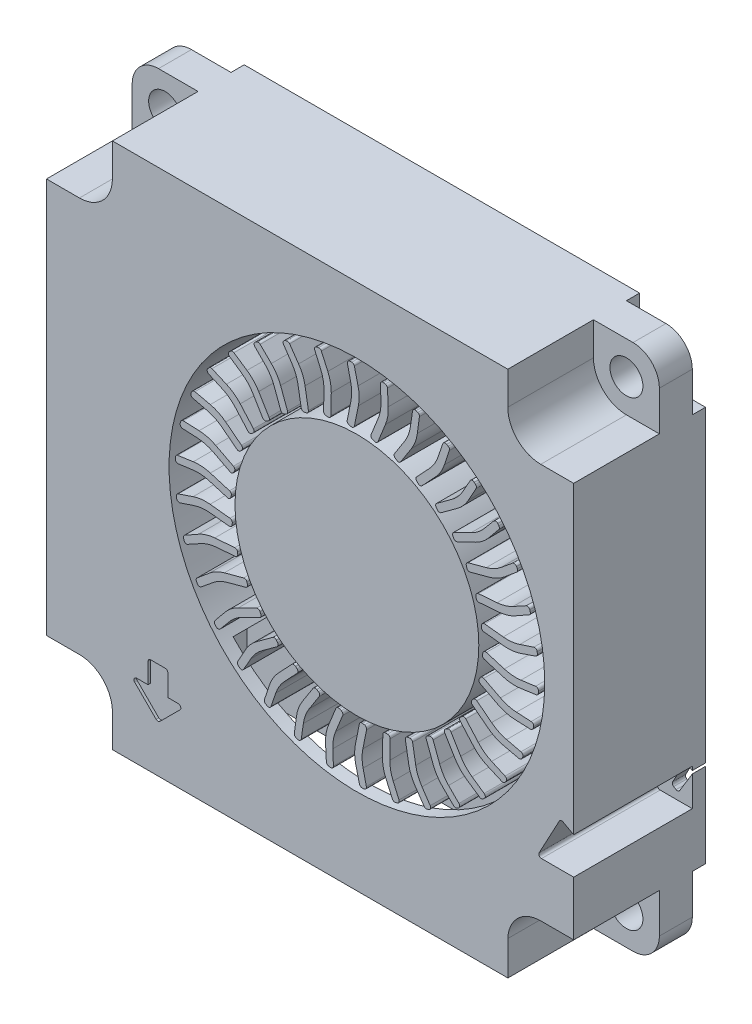
from build123d import *

# Parameters (mm, degrees)
SKETCH_1_R          = 1.25
EXTRUDE_1_DEPTH     = 10
CUT_EXTRUDE_1_DEPTH = 6.5
CUT_EXTRUDE_START   = -9
CUT_EXTRUDE_2_DEPTH = 6.5
SKETCH_5_W          = 27.606686678
SKETCH_5_H          = 8
CUT_EXTRUDE_3_DEPTH = 11
SKETCH_6_R          = 14.25
SKETCH_6_R_2        = 9.25
CUT_EXTRUDE_4_DEPTH = 8
EXTRUDE_2_DEPTH     = 8
CUT_EXTRUDE_5_DEPTH = 0.2
CUT_EXTRUDE_6_DEPTH = 9
CUT_EXTRUDE_7_DEPTH = 9


with BuildPart() as part:
    # Эскиз1 → Бобышка-Вытянуть1 (new body)
    with BuildSketch(Plane.XY):
        with BuildLine():
            Line((2, 0), (38, 0))
            ThreePointArc((38, 0), (39.414213562, 0.585786438), (40, 2))
            Line((40, 2), (40, 38))
            ThreePointArc((40, 38), (39.414213562, 39.414213562), (38, 40))
            Line((38, 40), (2, 40))
            ThreePointArc((2, 40), (0.585786438, 39.414213562), (0, 38))
            Line((0, 38), (0, 2))
            ThreePointArc((0, 2), (0.585786438, 0.585786438), (2, 0))
        make_face()
        with Locations((2.5, 37.5)):
            Circle(SKETCH_1_R, mode=Mode.SUBTRACT)
        with Locations((37.5, 37.5)):
            Circle(SKETCH_1_R, mode=Mode.SUBTRACT)
        with Locations((37.5, 2.5)):
            Circle(SKETCH_1_R, mode=Mode.SUBTRACT)
        with Locations((2.5, 2.5)):
            Circle(SKETCH_1_R, mode=Mode.SUBTRACT)
    extrude(amount=EXTRUDE_1_DEPTH)

    # Эскиз2 → Вырез-Вытянуть1 (cut)
    with BuildSketch(Plane.XY.offset(10)):
        with BuildLine():
            Line((5, 37.5), (5, 40))
            Line((5, 40), (-1.147181467, 40))
            Line((-1.147181467, 40), (-1.147181467, 35))
            Line((-1.147181467, 35), (2.5, 35))
            ThreePointArc((2.5, 35), (4.267766953, 35.732233047), (5, 37.5))
        make_face()
        with BuildLine():
            Line((37.5, 35), (44.720281608, 35))
            Line((44.720281608, 35), (44.720281608, 44.176160085))
            Line((44.720281608, 44.176160085), (35, 44.176160085))
            Line((35, 44.176160085), (35, 37.5))
            ThreePointArc((35, 37.5), (35.732233047, 35.732233047), (37.5, 35))
        make_face()
        with BuildLine():
            Line((37.5, 5.001596463), (44.720281608, 5.001596463))
            Line((44.720281608, 5.001596463), (44.720281608, -1.712904709))
            Line((44.720281608, -1.712904709), (35.01111003, -1.712904709))
            Line((35.01111003, -1.712904709), (35, 2.589358074))
            ThreePointArc((35, 2.589358074), (35.762984309, 4.300211475), (37.5, 5.001596463))
        make_face()
        with BuildLine():
            Line((5, 2.5), (5, -3.018162685))
            Line((5, -3.018162685), (-5.306764609, -3.018162685))
            Line((-5.306764609, -3.018162685), (-5.306764609, 5))
            Line((-5.306764609, 5), (2.5, 5))
            ThreePointArc((2.5, 5), (4.267766953, 4.267766953), (5, 2.5))
        make_face()
    extrude(amount=-CUT_EXTRUDE_1_DEPTH, mode=Mode.SUBTRACT)

    # Эскиз4 → Вырез-Вытянуть2 (cut)
    with BuildSketch(Plane.XY.offset(10).offset(CUT_EXTRUDE_START)):
        with BuildLine():
            Line((2, 0), (5, 0))
            Line((5, 0), (5, 2.5))
            ThreePointArc((5, 2.5), (4.267766953, 4.267766953), (2.5, 5))
            Line((2.5, 5), (0, 5))
            Line((0, 5), (0, 2))
            ThreePointArc((0, 2), (0.585786438, 0.585786438), (2, 0))
        make_face()
        with BuildLine():
            Line((35.006686678, 0), (38, 0))
            ThreePointArc((38, 0), (39.414213562, 0.585786438), (40, 2))
            Line((40, 2), (40, 5.001596463))
            Line((40, 5.001596463), (37.5, 5.001596463))
            ThreePointArc((37.5, 5.001596463), (35.762984309, 4.300211475), (35, 2.589358074))
            Line((35, 2.589358074), (35.006686678, 0))
        make_face()
        with BuildLine():
            Line((40, 35), (40, 38))
            ThreePointArc((40, 38), (39.414213562, 39.414213562), (38, 40))
            Line((38, 40), (35, 40))
            Line((35, 40), (35, 37.5))
            ThreePointArc((35, 37.5), (35.732233047, 35.732233047), (37.5, 35))
            Line((37.5, 35), (40, 35))
        make_face()
        with BuildLine():
            Line((0, 38), (0, 35))
            Line((0, 35), (2.5, 35))
            ThreePointArc((2.5, 35), (4.267766953, 35.732233047), (5, 37.5))
            Line((5, 37.5), (5, 40))
            Line((5, 40), (2, 40))
            ThreePointArc((2, 40), (0.585786438, 39.414213562), (0, 38))
        make_face()
    extrude(amount=-CUT_EXTRUDE_2_DEPTH, mode=Mode.SUBTRACT)

    # Эскиз5 → Вырез-Вытянуть3 (cut)
    with BuildSketch(Plane.XZ):
        with Locations((20.003343339, 5)):
            Rectangle(SKETCH_5_W, SKETCH_5_H)
    extrude(amount=-CUT_EXTRUDE_3_DEPTH, mode=Mode.SUBTRACT)

    # Эскиз6 → Вырез-Вытянуть4 (cut)
    with BuildSketch(Plane.XY.offset(10)):
        with Locations((23.55, 20.75)):
            Circle(SKETCH_6_R)
        with Locations((23.55, 20.75)):
            Circle(SKETCH_6_R_2, mode=Mode.SUBTRACT)
    extrude(amount=-CUT_EXTRUDE_4_DEPTH, mode=Mode.SUBTRACT)

    # Эскиз8 → Бобышка-Вытянуть2 (add)
    with BuildSketch(Plane.XY.offset(2)):
        with BuildLine():
            Line((23.025742906, 34.538315883), (23.163467517, 34.538315883))
            ThreePointArc((23.163467517, 34.538315883), (23.28725456, 34.495404292), (23.357922613, 34.385083564))
            Line((23.357922613, 34.385083564), (23.637701266, 33.221793375))
            ThreePointArc((23.637701266, 33.221793375), (23.720372981, 32.575149797), (23.661407551, 31.925915164))
            Line((23.661407551, 31.925915164), (23.36069347, 30.438171813))
            ThreePointArc((23.36069347, 30.438171813), (23.275257457, 30.311159431), (23.125033756, 30.281760499))
            Line((23.125033756, 30.281760499), (22.970769808, 30.312941509))
            ThreePointArc((22.970769808, 30.312941509), (22.843757426, 30.398377522), (22.814358494, 30.548601223))
            Line((22.814358494, 30.548601223), (23.096109078, 31.942525169))
            ThreePointArc((23.096109078, 31.942525169), (23.15532675, 32.575587505), (23.079797415, 33.20691149))
            Line((23.079797415, 33.20691149), (22.830794836, 34.293647661))
            ThreePointArc((22.830794836, 34.293647661), (22.869324166, 34.462948053), (23.025742906, 34.538315883))
        make_face()
        with BuildLine():
            Line((25.568265774, 34.399875591), (25.703645362, 34.37456876))
            ThreePointArc((25.703645362, 34.37456876), (25.817439711, 34.309642011), (25.866633125, 34.188214483))
            Line((25.866633125, 34.188214483), (25.927894004, 32.993322327))
            ThreePointArc((25.927894004, 32.993322327), (25.890337631, 32.342498197), (25.713079648, 31.715152887))
            Line((25.713079648, 31.715152887), (25.144113672, 30.307997261))
            ThreePointArc((25.144113672, 30.307997261), (25.036793906, 30.198846332), (24.883726009, 30.197551505))
            Line((24.883726009, 30.197551505), (24.737818194, 30.256547526))
            ThreePointArc((24.737818194, 30.256547526), (24.628667265, 30.363867292), (24.627372438, 30.516935189))
            Line((24.627372438, 30.516935189), (25.160458537, 31.835353396))
            ThreePointArc((25.160458537, 31.835353396), (25.334992814, 32.446755425), (25.376754988, 33.081208398))
            Line((25.376754988, 33.081208398), (25.331679397, 34.195194925))
            ThreePointArc((25.331679397, 34.195194925), (25.400661558, 34.35453291), (25.568265774, 34.399875591))
        make_face()
        with BuildLine():
            Line((28.042059022, 33.796605158), (28.170483398, 33.746853289))
            ThreePointArc((28.170483398, 33.746853289), (28.270409922, 33.662122384), (28.296453476, 33.533723125))
            Line((28.296453476, 33.533723125), (28.137110414, 32.347919622))
            ThreePointArc((28.137110414, 32.347919622), (27.980604889, 31.715077974), (27.691090663, 31.130985479))
            Line((27.691090663, 31.130985479), (26.873248246, 29.852336576))
            ThreePointArc((26.873248246, 29.852336576), (26.747699372, 29.764764104), (26.596999823, 29.791617476))
            Line((26.596999823, 29.791617476), (26.464416856, 29.876419468))
            ThreePointArc((26.464416856, 29.876419468), (26.376844385, 30.001968342), (26.403697757, 30.152667891))
            Line((26.403697757, 30.152667891), (27.169965761, 31.35068321))
            ThreePointArc((27.169965761, 31.35068321), (27.453873088, 31.919604368), (27.61150461, 32.535580794))
            Line((27.61150461, 32.535580794), (27.771891004, 33.638882201))
            ThreePointArc((27.771891004, 33.638882201), (27.86897689, 33.782831715), (28.042059022, 33.796605158))
        make_face()
        with BuildLine():
            Line((30.362880588, 32.749048233), (30.479976413, 32.676545567))
            ThreePointArc((30.479976413, 32.676545567), (30.562632235, 32.574895917), (30.564639045, 32.443897408))
            Line((30.564639045, 32.443897408), (30.19011828, 31.307563674))
            ThreePointArc((30.19011828, 31.307563674), (29.919993212, 30.714255173), (29.528081801, 30.193306062))
            Line((29.528081801, 30.193306062), (28.489213586, 29.086706735))
            ThreePointArc((28.489213586, 29.086706735), (28.349711021, 29.023694897), (28.206511712, 29.077782009))
            Line((28.206511712, 29.077782009), (28.091768547, 29.185502142))
            ThreePointArc((28.091768547, 29.185502142), (28.028756709, 29.325004707), (28.082843821, 29.468204015))
            Line((28.082843821, 29.468204015), (29.056199393, 30.50501947))
            ThreePointArc((29.056199393, 30.50501947), (29.439811647, 31.01208583), (29.707944564, 31.588609371))
            Line((29.707944564, 31.588609371), (30.068331177, 32.643654052))
            ThreePointArc((30.068331177, 32.643654052), (30.190214645, 32.767313068), (30.362880588, 32.749048233))
        make_face()
        with BuildLine():
            Line((32.451697676, 31.292878112), (32.553477392, 31.200093641))
            ThreePointArc((32.553477392, 31.200093641), (32.616047768, 31.084986801), (32.593949496, 30.95585004))
            Line((32.593949496, 30.95585004), (32.017004883, 29.907682558))
            ThreePointArc((32.017004883, 29.907682558), (31.642459056, 29.374111612), (31.161496533, 28.934046182))
            Line((31.161496533, 28.934046182), (29.936979931, 28.037180346))
            ThreePointArc((29.936979931, 28.037180346), (29.788274267, 28.000874933), (29.65745168, 28.080353913))
            Line((29.65745168, 28.080353913), (29.564455758, 28.207323907))
            ThreePointArc((29.564455758, 28.207323907), (29.528150345, 28.356029571), (29.607629325, 28.486852158))
            Line((29.607629325, 28.486852158), (30.754926009, 29.327160243))
            ThreePointArc((30.754926009, 29.327160243), (31.225179734, 29.755104267), (31.594683101, 30.272542105))
            Line((31.594683101, 30.272542105), (32.142797399, 31.24340178))
            ThreePointArc((32.142797399, 31.24340178), (32.285327854, 31.342559237), (32.451697676, 31.292878112))
        make_face()
        with BuildLine():
            Line((34.237378126, 29.477682921), (34.320375748, 29.367776308))
            ThreePointArc((34.320375748, 29.367776308), (34.360729918, 29.243132105), (34.315279093, 29.12025469))
            Line((34.315279093, 29.12025469), (33.555557789, 28.195947545))
            ThreePointArc((33.555557789, 28.195947545), (33.089345912, 27.740284274), (32.535710881, 27.396088426))
            Line((32.535710881, 27.396088426), (31.167245336, 26.73949777))
            ThreePointArc((31.167245336, 26.73949777), (31.014400566, 26.73113512), (30.900409706, 26.833299406))
            Line((30.900409706, 26.833299406), (30.832327892, 26.975195451))
            ThreePointArc((30.832327892, 26.975195451), (30.823965241, 27.12804022), (30.926129528, 27.24203108))
            Line((30.926129528, 27.24203108), (32.208297511, 27.85721611))
            ThreePointArc((32.208297511, 27.85721611), (32.749178781, 28.191464679), (33.207469604, 28.632196089))
            Line((33.207469604, 28.632196089), (33.924646211, 29.485809295))
            ThreePointArc((33.924646211, 29.485809295), (34.082969949, 29.557088506), (34.237378126, 29.477682921))
        make_face()
        with BuildLine():
            Line((35.659112733, 27.365276957), (35.720501875, 27.24199094))
            ThreePointArc((35.720501875, 27.24199094), (35.737265626, 27.112053981), (35.670010022, 26.999620355))
            Line((35.670010022, 26.999620355), (34.753383425, 26.230649719))
            ThreePointArc((34.753383425, 26.230649719), (34.211381785, 25.868411189), (33.603927621, 25.631806099))
            Line((33.603927621, 25.631806099), (32.138114586, 25.237850031))
            ThreePointArc((32.138114586, 25.237850031), (31.986335656, 25.257714923), (31.893058345, 25.379085434))
            Line((31.893058345, 25.379085434), (31.852209083, 25.53107543))
            ThreePointArc((31.852209083, 25.53107543), (31.872073975, 25.68285436), (31.993444486, 25.77613167))
            Line((31.993444486, 25.77613167), (33.366821076, 26.145244257))
            ThreePointArc((33.366821076, 26.145244257), (33.959910828, 26.374414937), (34.491382563, 26.723431339))
            Line((34.491382563, 26.723431339), (35.35319889, 27.430729302))
            ThreePointArc((35.35319889, 27.430729302), (35.521924386, 27.471702938), (35.659112733, 27.365276957))
        make_face()
        with BuildLine():
            Line((36.668486028, 25.02759567), (36.706176158, 24.895128606))
            ThreePointArc((36.706176158, 24.895128606), (36.698778621, 24.76432374), (36.612008547, 24.666162695))
            Line((36.612008547, 24.666162695), (35.569691275, 24.078714941))
            ThreePointArc((35.569691275, 24.078714941), (34.970357088, 23.822236749), (34.329769914, 23.701279721))
            Line((34.329769914, 23.701279721), (32.816525894, 23.583373942))
            ThreePointArc((32.816525894, 23.583373942), (32.670981453, 23.630789902), (32.601594139, 23.76723351))
            Line((32.601594139, 23.76723351), (32.589368501, 23.924141619))
            ThreePointArc((32.589368501, 23.924141619), (32.636784461, 24.06968606), (32.773228069, 24.139073374))
            Line((32.773228069, 24.139073374), (34.191044572, 24.249543832))
            ThreePointArc((34.191044572, 24.249543832), (34.816145846, 24.365832489), (35.402699861, 24.611248549))
            Line((35.402699861, 24.611248549), (36.379807787, 25.148145085))
            ThreePointArc((36.379807787, 25.148145085), (36.553189297, 25.157417839), (36.668486028, 25.02759567))
        make_face()
        with BuildLine():
            Line((37.231125016, 22.544245992), (37.24383264, 22.407108889))
            ThreePointArc((37.24383264, 22.407108889), (37.212525729, 22.279890518), (37.109196036, 22.199344811))
            Line((37.109196036, 22.199344811), (35.976682955, 21.813424767))
            ThreePointArc((35.976682955, 21.813424767), (35.340425828, 21.671440972), (34.688520072, 21.670251051))
            Line((34.688520072, 21.670251051), (33.179376777, 21.832410701))
            ThreePointArc((33.179376777, 21.832410701), (33.045023167, 21.905763035), (33.00188875, 22.052633317))
            Line((33.00188875, 22.052633317), (33.018703067, 22.209116223))
            ThreePointArc((33.018703067, 22.209116223), (33.092055401, 22.343469833), (33.238925683, 22.386604249))
            Line((33.238925683, 22.386604249), (34.652900059, 22.234670639))
            ThreePointArc((34.652900059, 22.234670639), (35.28872578, 22.234117203), (35.910387681, 22.367575571))
            Line((35.910387681, 22.367575571), (36.969512967, 22.715787313))
            ThreePointArc((36.969512967, 22.715787313), (37.141646192, 22.693043411), (37.231125016, 22.544245992))
        make_face()
        with BuildLine():
            Line((37.3278697, 19.99979542), (37.315162076, 19.862658317))
            ThreePointArc((37.315162076, 19.862658317), (37.261011911, 19.74335871), (37.144641367, 19.683171228))
            Line((37.144641367, 19.683171228), (35.960498852, 19.511920938))
            ThreePointArc((35.960498852, 19.511920938), (35.308985757, 19.489266628), (34.667961288, 19.607884336))
            Line((34.667961288, 19.607884336), (33.214310783, 20.044587263))
            ThreePointArc((33.214310783, 20.044587263), (33.095723254, 20.141378045), (33.080310627, 20.293673509))
            Line((33.080310627, 20.293673509), (33.125592306, 20.444402373))
            ThreePointArc((33.125592306, 20.444402373), (33.222383088, 20.562989902), (33.374678553, 20.57840253))
            Line((33.374678553, 20.57840253), (34.7366596, 20.169238767))
            ThreePointArc((34.7366596, 20.169238767), (35.361557487, 20.051862085), (35.997157323, 20.068817996))
            Line((35.997157323, 20.068817996), (37.102232729, 20.216487011))
            ThreePointArc((37.102232729, 20.216487011), (37.267255877, 20.162500971), (37.3278697, 19.99979542))
        make_face()
        with BuildLine():
            Line((36.955425557, 17.480892164), (36.917735427, 17.348425101))
            ThreePointArc((36.917735427, 17.348425101), (36.842586026, 17.241106864), (36.717137491, 17.203327219))
            Line((36.717137491, 17.203327219), (35.521690094, 17.252578407))
            ThreePointArc((35.521690094, 17.252578407), (34.877107529, 17.350025046), (34.268793667, 17.584411))
            Line((34.268793667, 17.584411), (32.920138276, 18.280785809))
            ThreePointArc((32.920138276, 18.280785809), (32.821355185, 18.397718945), (32.834189205, 18.550253352))
            Line((32.834189205, 18.550253352), (32.906396234, 18.690095285))
            ThreePointArc((32.906396234, 18.690095285), (33.02332937, 18.788878376), (33.175863778, 18.776044356))
            Line((33.175863778, 18.776044356), (34.439470866, 18.123584023))
            ThreePointArc((34.439470866, 18.123584023), (35.03216077, 17.893381217), (35.660053951, 17.793257258))
            Line((35.660053951, 17.793257258), (36.773447458, 17.735354854))
            ThreePointArc((36.773447458, 17.735354854), (36.925740865, 17.651965105), (36.955425557, 17.480892164))
        make_face()
        with BuildLine():
            Line((36.126475723, 15.073314456), (36.065086581, 14.950028439))
            ThreePointArc((36.065086581, 14.950028439), (35.971497067, 14.858346164), (35.84124254, 14.844260898))
            Line((35.84124254, 14.844260898), (34.675199789, 15.112336374))
            ThreePointArc((34.675199789, 15.112336374), (34.05949824, 15.326565534), (33.504610383, 15.668738))
            Line((33.504610383, 15.668738), (32.306876949, 16.601070482))
            ThreePointArc((32.306876949, 16.601070482), (32.231262235, 16.734163955), (32.271905855, 16.88174293))
            Line((32.271905855, 16.88174293), (32.36857931, 17.00593578))
            ThreePointArc((32.36857931, 17.00593578), (32.501672783, 17.081550494), (32.649251757, 17.040906874))
            Line((32.649251757, 17.040906874), (33.771454262, 16.167368726))
            ThreePointArc((33.771454262, 16.167368726), (34.311752839, 15.832179075), (34.910557217, 15.618384848))
            Line((34.910557217, 15.618384848), (35.994353545, 15.356882822))
            ThreePointArc((35.994353545, 15.356882822), (36.128731041, 15.246929102), (36.126475723, 15.073314456))
        make_face()
        with BuildLine():
            Line((34.869249093, 12.859049464), (34.786251472, 12.749142852))
            ThreePointArc((34.786251472, 12.749142852), (34.677408923, 12.67621867), (34.546784066, 12.686307438))
            Line((34.546784066, 12.686307438), (33.449854148, 13.164078214))
            ThreePointArc((33.449854148, 13.164078214), (32.884000593, 13.487794578), (32.401434782, 13.926101284))
            Line((32.401434782, 13.926101284), (31.39541068, 15.062641975))
            ThreePointArc((31.39541068, 15.062641975), (31.345539311, 15.207363446), (31.412608462, 15.344961362))
            Line((31.412608462, 15.344961362), (31.530456244, 15.449275893))
            ThreePointArc((31.530456244, 15.449275893), (31.675177715, 15.499147261), (31.812775631, 15.43207811))
            Line((31.812775631, 15.43207811), (32.755358292, 14.367209439))
            ThreePointArc((32.755358292, 14.367209439), (33.224866323, 13.938447427), (33.774190332, 13.618263437))
            Line((33.774190332, 13.618263437), (34.791482097, 13.162066928))
            ThreePointArc((34.791482097, 13.162066928), (34.903367617, 13.029293578), (34.869249093, 12.859049464))
        make_face()
        with BuildLine():
            Line((33.226559011, 10.91350133), (33.124779295, 10.820716859))
            ThreePointArc((33.124779295, 10.820716859), (33.004390215, 10.769034116), (32.8778433, 10.802953358))
            Line((32.8778433, 10.802953358), (31.887380848, 11.474149521))
            ThreePointArc((31.887380848, 11.474149521), (31.390644751, 11.896329318), (30.996834186, 12.415844254))
            Line((30.996834186, 12.415844254), (30.216778359, 13.717889623))
            ThreePointArc((30.216778359, 13.717889623), (30.194348646, 13.869310776), (30.285559368, 13.992241902))
            Line((30.285559368, 13.992241902), (30.420568312, 14.073125807))
            ThreePointArc((30.420568312, 14.073125807), (30.571989465, 14.09555552), (30.694920591, 14.004344798))
            Line((30.694920591, 14.004344798), (31.425784886, 12.784408431))
            ThreePointArc((31.425784886, 12.784408431), (31.808513837, 12.276675032), (32.289650907, 11.861004761))
            Line((32.289650907, 11.861004761), (33.205795458, 11.225648993))
            ThreePointArc((33.205795458, 11.225648993), (33.291378876, 11.074577452), (33.226559011, 10.91350133))
        make_face()
        with BuildLine():
            Line((31.254345318, 9.30292336), (31.137249493, 9.230420694))
            ThreePointArc((31.137249493, 9.230420694), (31.009413586, 9.201739384), (30.891254018, 9.258334021))
            Line((30.891254018, 9.258334021), (30.040988043, 10.100098792))
            ThreePointArc((30.040988043, 10.100098792), (29.630285156, 10.606365193), (29.338640583, 11.189396902))
            Line((29.338640583, 11.189396902), (28.811116898, 12.612607357))
            ThreePointArc((28.811116898, 12.612607357), (28.816892657, 12.765571726), (28.929138878, 12.86964979))
            Line((28.929138878, 12.86964979), (29.076711417, 12.924348664))
            ThreePointArc((29.076711417, 12.924348664), (29.229675786, 12.918572904), (29.333753849, 12.806326683))
            Line((29.333753849, 12.806326683), (29.828011072, 11.472866089))
            ThreePointArc((29.828011072, 11.472866089), (30.110927568, 10.903451556), (30.507493154, 10.406450156))
            Line((30.507493154, 10.406450156), (31.291292286, 9.613571408))
            ThreePointArc((31.291292286, 9.613571408), (31.347659161, 9.449346236), (31.254345318, 9.30292336))
        make_face()
        with BuildLine():
            Line((29.019769385, 8.082161855), (28.891345009, 8.032409987))
            ThreePointArc((28.891345009, 8.032409987), (28.760415575, 8.027706817), (28.654667135, 8.105049586))
            Line((28.654667135, 8.105049586), (27.973552425, 9.088717675))
            ThreePointArc((27.973552425, 9.088717675), (27.662868742, 9.661830386), (27.483321767, 10.288524422))
            Line((27.483321767, 10.288524422), (27.22629441, 11.784434237))
            ThreePointArc((27.22629441, 11.784434237), (27.260078955, 11.933732804), (27.389538265, 12.015413552))
            Line((27.389538265, 12.015413552), (27.544648993, 12.042064691))
            ThreePointArc((27.544648993, 12.042064691), (27.69394756, 12.008280146), (27.775628308, 11.878820836))
            Line((27.775628308, 11.878820836), (28.01644712, 10.477245416))
            ThreePointArc((28.01644712, 10.477245416), (28.18991678, 9.865540478), (28.488406315, 9.304132736))
            Line((28.488406315, 9.304132736), (29.11316869, 8.380731543))
            ThreePointArc((29.11316869, 8.380731543), (29.138399516, 8.20894523), (29.019769385, 8.082161855))
        make_face()
        with BuildLine():
            Line((26.598927016, 7.292788385), (26.463547428, 7.267481554))
            ThreePointArc((26.463547428, 7.267481554), (26.33398311, 7.286916685), (26.244246935, 7.382373772))
            Line((26.244246935, 7.382373772), (25.755478034, 8.474447542))
            ThreePointArc((25.755478034, 8.474447542), (25.555393516, 9.094889897), (25.494058397, 9.743904946))
            Line((25.494058397, 9.743904946), (25.516280126, 11.261572706))
            ThreePointArc((25.516280126, 11.261572706), (25.576922965, 11.402121287), (25.719186782, 11.45862318))
            Line((25.719186782, 11.45862318), (25.876553588, 11.456319011))
            ThreePointArc((25.876553588, 11.456319011), (26.017102169, 11.395676172), (26.073604062, 11.253412355))
            Line((26.073604062, 11.253412355), (26.052783669, 9.83145108))
            ThreePointArc((26.052783669, 9.83145108), (26.11089919, 9.198286614), (26.301147972, 8.591590598))
            Line((26.301147972, 8.591590598), (26.745598057, 7.56911228))
            ThreePointArc((26.745598057, 7.56911228), (26.738833627, 7.395614803), (26.598927016, 7.292788385))
        make_face()
        with BuildLine():
            Line((24.074257094, 6.961684117), (23.936532483, 6.961684117))
            ThreePointArc((23.936532483, 6.961684117), (23.81274544, 7.004595708), (23.742077387, 7.114916436))
            Line((23.742077387, 7.114916436), (23.462298734, 8.278206625))
            ThreePointArc((23.462298734, 8.278206625), (23.379627019, 8.924850203), (23.438592449, 9.574084836))
            Line((23.438592449, 9.574084836), (23.73930653, 11.061828187))
            ThreePointArc((23.73930653, 11.061828187), (23.824742543, 11.188840569), (23.974966244, 11.218239501))
            Line((23.974966244, 11.218239501), (24.129230192, 11.187058491))
            ThreePointArc((24.129230192, 11.187058491), (24.256242574, 11.101622478), (24.285641506, 10.951398777))
            Line((24.285641506, 10.951398777), (24.003890922, 9.557474831))
            ThreePointArc((24.003890922, 9.557474831), (23.94467325, 8.924412495), (24.020202585, 8.29308851))
            Line((24.020202585, 8.29308851), (24.269205164, 7.206352339))
            ThreePointArc((24.269205164, 7.206352339), (24.230675834, 7.037051947), (24.074257094, 6.961684117))
        make_face()
        with BuildLine():
            Line((21.531734226, 7.100124409), (21.396354638, 7.12543124))
            ThreePointArc((21.396354638, 7.12543124), (21.282560289, 7.190357989), (21.233366875, 7.311785517))
            Line((21.233366875, 7.311785517), (21.172105996, 8.506677673))
            ThreePointArc((21.172105996, 8.506677673), (21.209662369, 9.157501803), (21.386920352, 9.784847113))
            Line((21.386920352, 9.784847113), (21.955886328, 11.192002739))
            ThreePointArc((21.955886328, 11.192002739), (22.063206094, 11.301153668), (22.216273991, 11.302448495))
            Line((22.216273991, 11.302448495), (22.362181806, 11.243452474))
            ThreePointArc((22.362181806, 11.243452474), (22.471332735, 11.136132708), (22.472627562, 10.983064811))
            Line((22.472627562, 10.983064811), (21.939541463, 9.664646604))
            ThreePointArc((21.939541463, 9.664646604), (21.765007186, 9.053244575), (21.723245012, 8.418791602))
            Line((21.723245012, 8.418791602), (21.768320603, 7.304805075))
            ThreePointArc((21.768320603, 7.304805075), (21.699338442, 7.14546709), (21.531734226, 7.100124409))
        make_face()
        with BuildLine():
            Line((19.057940978, 7.703394842), (18.929516602, 7.753146711))
            ThreePointArc((18.929516602, 7.753146711), (18.829590078, 7.837877616), (18.803546524, 7.966276875))
            Line((18.803546524, 7.966276875), (18.962889586, 9.152080378))
            ThreePointArc((18.962889586, 9.152080378), (19.119395111, 9.784922026), (19.408909337, 10.369014521))
            Line((19.408909337, 10.369014521), (20.226751754, 11.647663424))
            ThreePointArc((20.226751754, 11.647663424), (20.352300628, 11.735235896), (20.503000177, 11.708382524))
            Line((20.503000177, 11.708382524), (20.635583144, 11.623580532))
            ThreePointArc((20.635583144, 11.623580532), (20.723155615, 11.498031658), (20.696302243, 11.347332109))
            Line((20.696302243, 11.347332109), (19.930034239, 10.14931679))
            ThreePointArc((19.930034239, 10.14931679), (19.646126912, 9.580395632), (19.48849539, 8.964419206))
            Line((19.48849539, 8.964419206), (19.328108996, 7.861117799))
            ThreePointArc((19.328108996, 7.861117799), (19.23102311, 7.717168285), (19.057940978, 7.703394842))
        make_face()
        with BuildLine():
            Line((16.737119413, 8.750951767), (16.620023587, 8.823454433))
            ThreePointArc((16.620023587, 8.823454433), (16.537367765, 8.925104083), (16.535360955, 9.056102592))
            Line((16.535360955, 9.056102592), (16.90988172, 10.192436326))
            ThreePointArc((16.90988172, 10.192436326), (17.180006788, 10.785744827), (17.571918199, 11.306693938))
            Line((17.571918199, 11.306693938), (18.610786414, 12.413293265))
            ThreePointArc((18.610786414, 12.413293265), (18.750288979, 12.476305103), (18.893488288, 12.422217991))
            Line((18.893488288, 12.422217991), (19.008231453, 12.314497858))
            ThreePointArc((19.008231453, 12.314497858), (19.071243291, 12.174995293), (19.017156179, 12.031795985))
            Line((19.017156179, 12.031795985), (18.043800607, 10.99498053))
            ThreePointArc((18.043800607, 10.99498053), (17.660188353, 10.48791417), (17.392055436, 9.911390629))
            Line((17.392055436, 9.911390629), (17.031668823, 8.856345948))
            ThreePointArc((17.031668823, 8.856345948), (16.909785355, 8.732686932), (16.737119413, 8.750951767))
        make_face()
        with BuildLine():
            Line((14.648302324, 10.207121888), (14.546522608, 10.299906359))
            ThreePointArc((14.546522608, 10.299906359), (14.483952232, 10.415013199), (14.506050504, 10.54414996))
            Line((14.506050504, 10.54414996), (15.082995117, 11.592317442))
            ThreePointArc((15.082995117, 11.592317442), (15.457540944, 12.125888388), (15.938503467, 12.565953818))
            Line((15.938503467, 12.565953818), (17.163020069, 13.462819654))
            ThreePointArc((17.163020069, 13.462819654), (17.311725733, 13.499125067), (17.44254832, 13.419646087))
            Line((17.44254832, 13.419646087), (17.535544242, 13.292676093))
            ThreePointArc((17.535544242, 13.292676093), (17.571849655, 13.143970429), (17.492370675, 13.013147842))
            Line((17.492370675, 13.013147842), (16.345073991, 12.172839757))
            ThreePointArc((16.345073991, 12.172839757), (15.874820266, 11.744895733), (15.505316899, 11.227457895))
            Line((15.505316899, 11.227457895), (14.957202601, 10.25659822))
            ThreePointArc((14.957202601, 10.25659822), (14.814672146, 10.157440763), (14.648302324, 10.207121888))
        make_face()
        with BuildLine():
            Line((12.862621874, 12.022317079), (12.779624252, 12.132223692))
            ThreePointArc((12.779624252, 12.132223692), (12.739270082, 12.256867895), (12.784720907, 12.37974531))
            Line((12.784720907, 12.37974531), (13.544442211, 13.304052455))
            ThreePointArc((13.544442211, 13.304052455), (14.010654088, 13.759715726), (14.564289119, 14.103911574))
            Line((14.564289119, 14.103911574), (15.932754664, 14.76050223))
            ThreePointArc((15.932754664, 14.76050223), (16.085599434, 14.76886488), (16.199590294, 14.666700594))
            Line((16.199590294, 14.666700594), (16.267672108, 14.524804549))
            ThreePointArc((16.267672108, 14.524804549), (16.276034759, 14.37195978), (16.173870472, 14.25796892))
            Line((16.173870472, 14.25796892), (14.891702489, 13.64278389))
            ThreePointArc((14.891702489, 13.64278389), (14.350821219, 13.308535321), (13.892530396, 12.867803911))
            Line((13.892530396, 12.867803911), (13.175353789, 12.014190705))
            ThreePointArc((13.175353789, 12.014190705), (13.017030051, 11.942911494), (12.862621874, 12.022317079))
        make_face()
        with BuildLine():
            Line((11.440887267, 14.134723043), (11.379498125, 14.25800906))
            ThreePointArc((11.379498125, 14.25800906), (11.362734374, 14.387946019), (11.429989978, 14.500379645))
            Line((11.429989978, 14.500379645), (12.346616575, 15.269350281))
            ThreePointArc((12.346616575, 15.269350281), (12.888618215, 15.631588811), (13.496072379, 15.868193901))
            Line((13.496072379, 15.868193901), (14.961885414, 16.262149969))
            ThreePointArc((14.961885414, 16.262149969), (15.113664344, 16.242285077), (15.206941655, 16.120914566))
            Line((15.206941655, 16.120914566), (15.247790917, 15.96892457))
            ThreePointArc((15.247790917, 15.96892457), (15.227926025, 15.81714564), (15.106555514, 15.72386833))
            Line((15.106555514, 15.72386833), (13.733178924, 15.354755743))
            ThreePointArc((13.733178924, 15.354755743), (13.140089172, 15.125585063), (12.608617437, 14.776568661))
            Line((12.608617437, 14.776568661), (11.74680111, 14.069270698))
            ThreePointArc((11.74680111, 14.069270698), (11.578075614, 14.028297062), (11.440887267, 14.134723043))
        make_face()
        with BuildLine():
            Line((10.431513972, 16.47240433), (10.393823842, 16.604871394))
            ThreePointArc((10.393823842, 16.604871394), (10.401221379, 16.73567626), (10.487991453, 16.833837305))
            Line((10.487991453, 16.833837305), (11.530308725, 17.421285059))
            ThreePointArc((11.530308725, 17.421285059), (12.129642912, 17.677763251), (12.770230086, 17.798720279))
            Line((12.770230086, 17.798720279), (14.283474106, 17.916626058))
            ThreePointArc((14.283474106, 17.916626058), (14.429018547, 17.869210098), (14.498405861, 17.73276649))
            Line((14.498405861, 17.73276649), (14.510631499, 17.575858381))
            ThreePointArc((14.510631499, 17.575858381), (14.463215539, 17.43031394), (14.326771931, 17.360926626))
            Line((14.326771931, 17.360926626), (12.908955428, 17.250456168))
            ThreePointArc((12.908955428, 17.250456168), (12.283854154, 17.134167511), (11.697300139, 16.888751451))
            Line((11.697300139, 16.888751451), (10.720192213, 16.351854915))
            ThreePointArc((10.720192213, 16.351854915), (10.546810703, 16.342582161), (10.431513972, 16.47240433))
        make_face()
        with BuildLine():
            Line((9.868874984, 18.955754008), (9.85616736, 19.092891111))
            ThreePointArc((9.85616736, 19.092891111), (9.887474271, 19.220109482), (9.990803964, 19.300655189))
            Line((9.990803964, 19.300655189), (11.123317045, 19.686575233))
            ThreePointArc((11.123317045, 19.686575233), (11.759574172, 19.828559028), (12.411479928, 19.829748949))
            Line((12.411479928, 19.829748949), (13.920623223, 19.667589299))
            ThreePointArc((13.920623223, 19.667589299), (14.054976833, 19.594236965), (14.09811125, 19.447366683))
            Line((14.09811125, 19.447366683), (14.081296933, 19.290883777))
            ThreePointArc((14.081296933, 19.290883777), (14.007944599, 19.156530167), (13.861074317, 19.113395751))
            Line((13.861074317, 19.113395751), (12.447099941, 19.265329361))
            ThreePointArc((12.447099941, 19.265329361), (11.81127422, 19.265882797), (11.189612319, 19.132424429))
            Line((11.189612319, 19.132424429), (10.130487033, 18.784212687))
            ThreePointArc((10.130487033, 18.784212687), (9.958353808, 18.806956589), (9.868874984, 18.955754008))
        make_face()
        with BuildLine():
            Line((9.7721303, 21.50020458), (9.784837924, 21.637341683))
            ThreePointArc((9.784837924, 21.637341683), (9.838988089, 21.75664129), (9.955358633, 21.816828772))
            Line((9.955358633, 21.816828772), (11.139501148, 21.988079062))
            ThreePointArc((11.139501148, 21.988079062), (11.791014243, 22.010733372), (12.432038712, 21.892115664))
            Line((12.432038712, 21.892115664), (13.885689217, 21.455412737))
            ThreePointArc((13.885689217, 21.455412737), (14.004276746, 21.358621955), (14.019689373, 21.206326491))
            Line((14.019689373, 21.206326491), (13.974407694, 21.055597627))
            ThreePointArc((13.974407694, 21.055597627), (13.877616912, 20.937010098), (13.725321447, 20.92159747))
            Line((13.725321447, 20.92159747), (12.3633404, 21.330761233))
            ThreePointArc((12.3633404, 21.330761233), (11.738442513, 21.448137915), (11.102842677, 21.431182004))
            Line((11.102842677, 21.431182004), (9.997767271, 21.283512989))
            ThreePointArc((9.997767271, 21.283512989), (9.832744123, 21.337499029), (9.7721303, 21.50020458))
        make_face()
        with BuildLine():
            Line((10.144574443, 24.019107836), (10.182264573, 24.151574899))
            ThreePointArc((10.182264573, 24.151574899), (10.257413974, 24.258893136), (10.382862509, 24.296672781))
            Line((10.382862509, 24.296672781), (11.578309906, 24.247421593))
            ThreePointArc((11.578309906, 24.247421593), (12.222892471, 24.149974954), (12.831206333, 23.915589))
            Line((12.831206333, 23.915589), (14.179861724, 23.219214191))
            ThreePointArc((14.179861724, 23.219214191), (14.278644815, 23.102281055), (14.265810795, 22.949746648))
            Line((14.265810795, 22.949746648), (14.193603766, 22.809904715))
            ThreePointArc((14.193603766, 22.809904715), (14.07667063, 22.711121624), (13.924136222, 22.723955644))
            Line((13.924136222, 22.723955644), (12.660529134, 23.376415977))
            ThreePointArc((12.660529134, 23.376415977), (12.06783923, 23.606618783), (11.439946049, 23.706742742))
            Line((11.439946049, 23.706742742), (10.326552542, 23.764645146))
            ThreePointArc((10.326552542, 23.764645146), (10.174259135, 23.848034895), (10.144574443, 24.019107836))
        make_face()
        with BuildLine():
            Line((10.973524277, 26.426685544), (11.034913419, 26.549971561))
            ThreePointArc((11.034913419, 26.549971561), (11.128502933, 26.641653836), (11.25875746, 26.655739102))
            Line((11.25875746, 26.655739102), (12.424800211, 26.387663626))
            ThreePointArc((12.424800211, 26.387663626), (13.04050176, 26.173434466), (13.595389617, 25.831262))
            Line((13.595389617, 25.831262), (14.793123051, 24.898929518))
            ThreePointArc((14.793123051, 24.898929518), (14.868737765, 24.765836045), (14.828094145, 24.61825707))
            Line((14.828094145, 24.61825707), (14.73142069, 24.49406422))
            ThreePointArc((14.73142069, 24.49406422), (14.598327217, 24.418449506), (14.450748243, 24.459093126))
            Line((14.450748243, 24.459093126), (13.328545738, 25.332631274))
            ThreePointArc((13.328545738, 25.332631274), (12.788247161, 25.667820925), (12.189442783, 25.881615152))
            Line((12.189442783, 25.881615152), (11.105646455, 26.143117178))
            ThreePointArc((11.105646455, 26.143117178), (10.971268959, 26.253070898), (10.973524277, 26.426685544))
        make_face()
        with BuildLine():
            Line((12.230750907, 28.640950536), (12.313748528, 28.750857148))
            ThreePointArc((12.313748528, 28.750857148), (12.422591077, 28.82378133), (12.553215934, 28.813692562))
            Line((12.553215934, 28.813692562), (13.650145852, 28.335921786))
            ThreePointArc((13.650145852, 28.335921786), (14.215999407, 28.012205422), (14.698565218, 27.573898716))
            Line((14.698565218, 27.573898716), (15.70458932, 26.437358025))
            ThreePointArc((15.70458932, 26.437358025), (15.754460689, 26.292636554), (15.687391538, 26.155038638))
            Line((15.687391538, 26.155038638), (15.569543756, 26.050724107))
            ThreePointArc((15.569543756, 26.050724107), (15.424822285, 26.000852739), (15.287224369, 26.06792189))
            Line((15.287224369, 26.06792189), (14.344641708, 27.132790561))
            ThreePointArc((14.344641708, 27.132790561), (13.875133677, 27.561552573), (13.325809668, 27.881736563))
            Line((13.325809668, 27.881736563), (12.308517903, 28.337933072))
            ThreePointArc((12.308517903, 28.337933072), (12.196632383, 28.470706422), (12.230750907, 28.640950536))
        make_face()
        with BuildLine():
            Line((13.873440989, 30.58649867), (13.975220705, 30.679283141))
            ThreePointArc((13.975220705, 30.679283141), (14.095609785, 30.730965884), (14.2221567, 30.697046642))
            Line((14.2221567, 30.697046642), (15.212619152, 30.025850479))
            ThreePointArc((15.212619152, 30.025850479), (15.709355249, 29.603670682), (16.103165814, 29.084155746))
            Line((16.103165814, 29.084155746), (16.883221641, 27.782110377))
            ThreePointArc((16.883221641, 27.782110377), (16.905651354, 27.630689224), (16.814440632, 27.507758098))
            Line((16.814440632, 27.507758098), (16.679431688, 27.426874193))
            ThreePointArc((16.679431688, 27.426874193), (16.528010535, 27.40444448), (16.405079409, 27.495655202))
            Line((16.405079409, 27.495655202), (15.674215114, 28.715591569))
            ThreePointArc((15.674215114, 28.715591569), (15.291486163, 29.223324968), (14.810349093, 29.638995239))
            Line((14.810349093, 29.638995239), (13.894204542, 30.274351007))
            ThreePointArc((13.894204542, 30.274351007), (13.808621124, 30.425422548), (13.873440989, 30.58649867))
        make_face()
        with BuildLine():
            Line((15.845654682, 32.19707664), (15.962750507, 32.269579306))
            ThreePointArc((15.962750507, 32.269579306), (16.090586414, 32.298260616), (16.208745982, 32.241665979))
            Line((16.208745982, 32.241665979), (17.059011957, 31.399901208))
            ThreePointArc((17.059011957, 31.399901208), (17.469714844, 30.893634807), (17.761359417, 30.310603098))
            Line((17.761359417, 30.310603098), (18.288883102, 28.887392643))
            ThreePointArc((18.288883102, 28.887392643), (18.283107343, 28.734428274), (18.170861122, 28.63035021))
            Line((18.170861122, 28.63035021), (18.023288583, 28.575651336))
            ThreePointArc((18.023288583, 28.575651336), (17.870324214, 28.581427096), (17.766246151, 28.693673317))
            Line((17.766246151, 28.693673317), (17.271988928, 30.027133911))
            ThreePointArc((17.271988928, 30.027133911), (16.989072432, 30.596548444), (16.592506846, 31.093549844))
            Line((16.592506846, 31.093549844), (15.808707714, 31.886428592))
            ThreePointArc((15.808707714, 31.886428592), (15.752340839, 32.050653764), (15.845654682, 32.19707664))
        make_face()
        with BuildLine():
            Line((18.080230615, 33.417838145), (18.208654991, 33.467590013))
            ThreePointArc((18.208654991, 33.467590013), (18.339584425, 33.472293183), (18.445332865, 33.394950414))
            Line((18.445332865, 33.394950414), (19.126447575, 32.411282325))
            ThreePointArc((19.126447575, 32.411282325), (19.437131258, 31.838169614), (19.616678233, 31.211475578))
            Line((19.616678233, 31.211475578), (19.87370559, 29.715565763))
            ThreePointArc((19.87370559, 29.715565763), (19.839921045, 29.566267196), (19.710461735, 29.484586448))
            Line((19.710461735, 29.484586448), (19.555351007, 29.457935309))
            ThreePointArc((19.555351007, 29.457935309), (19.40605244, 29.491719854), (19.324371692, 29.621179164))
            Line((19.324371692, 29.621179164), (19.08355288, 31.022754584))
            ThreePointArc((19.08355288, 31.022754584), (18.91008322, 31.634459522), (18.611593685, 32.195867264))
            Line((18.611593685, 32.195867264), (17.98683131, 33.119268457))
            ThreePointArc((17.98683131, 33.119268457), (17.961600484, 33.29105477), (18.080230615, 33.417838145))
        make_face()
        with BuildLine():
            Line((20.501072984, 34.207211615), (20.636452572, 34.232518446))
            ThreePointArc((20.636452572, 34.232518446), (20.76601689, 34.213083315), (20.855753065, 34.117626228))
            Line((20.855753065, 34.117626228), (21.344521966, 33.025552458))
            ThreePointArc((21.344521966, 33.025552458), (21.544606484, 32.405110103), (21.605941603, 31.756095054))
            Line((21.605941603, 31.756095054), (21.583719874, 30.238427294))
            ThreePointArc((21.583719874, 30.238427294), (21.523077035, 30.097878713), (21.380813218, 30.04137682))
            Line((21.380813218, 30.04137682), (21.223446412, 30.043680989))
            ThreePointArc((21.223446412, 30.043680989), (21.082897831, 30.104323828), (21.026395938, 30.246587645))
            Line((21.026395938, 30.246587645), (21.047216331, 31.66854892))
            ThreePointArc((21.047216331, 31.66854892), (20.98910081, 32.301713386), (20.798852028, 32.908409402))
            Line((20.798852028, 32.908409402), (20.354401943, 33.93088772))
            ThreePointArc((20.354401943, 33.93088772), (20.361166373, 34.104385197), (20.501072984, 34.207211615))
        make_face()
    extrude(amount=EXTRUDE_2_DEPTH)

    # Эскиз9 → Вырез-Вытянуть5 (cut)
    with BuildSketch(Plane.XY.offset(10)):
        with BuildLine():
            Line((7.904420418, 7.354359837), (9.004337591, 7.354359837))
            ThreePointArc((9.004337591, 7.354359837), (9.145758947, 7.295781194), (9.204337591, 7.154359837))
            Line((9.204337591, 7.154359837), (9.204337591, 5.527429873))
            Line((9.204337591, 5.527429873), (9.991848397, 5.527429873))
            ThreePointArc((9.991848397, 5.527429873), (10.176624303, 5.403966559), (10.133269753, 5.186008516))
            Line((10.133269753, 5.186008516), (8.599782682, 3.652521445))
            ThreePointArc((8.599782682, 3.652521445), (8.458361326, 3.593942802), (8.316939969, 3.652521445))
            Line((8.316939969, 3.652521445), (6.692335592, 5.277125822))
            ThreePointArc((6.692335592, 5.277125822), (6.648981042, 5.495083865), (6.833756948, 5.618547179))
            Line((6.833756948, 5.618547179), (7.704420418, 5.618547179))
            Line((7.704420418, 5.618547179), (7.704420418, 7.154359837))
            ThreePointArc((7.704420418, 7.154359837), (7.762999062, 7.295781194), (7.904420418, 7.354359837))
        make_face()
    extrude(amount=-CUT_EXTRUDE_5_DEPTH, mode=Mode.SUBTRACT)

    # Эскиз10 → Вырез-Вытянуть6 (cut)
    with BuildSketch(Plane.XY.offset(10)):
        with BuildLine():
            Line((40, 11.912023233), (39.181629679, 12.351295083))
            ThreePointArc((39.181629679, 12.351295083), (39.029319897, 12.366565573), (38.910822751, 12.26966416))
            Line((38.910822751, 12.26966416), (37.37991348, 9.417556267))
            ThreePointArc((37.37991348, 9.417556267), (37.384496744, 9.220297919), (37.556132405, 9.122968265))
            Line((37.556132405, 9.122968265), (40.261157045, 9.122968265))
            ThreePointArc((40.261157045, 9.122968265), (40.414554157, 9.194635393), (40.458015964, 9.358275006))
            Line((40.458015964, 9.358275006), (40, 11.912023233))
        make_face()
    extrude(amount=-CUT_EXTRUDE_6_DEPTH, mode=Mode.SUBTRACT)

    # Эскиз11 → Вырез-Вытянуть7 (cut)
    with BuildSketch(Plane.XY.offset(1)):
        with BuildLine():
            Line((40, 11.625081388), (39.650849952, 11.81605018))
            ThreePointArc((39.650849952, 11.81605018), (39.498665173, 11.832519861), (39.37940846, 11.736554794))
            Line((39.37940846, 11.736554794), (38.503357673, 10.134862862))
            ThreePointArc((38.503357673, 10.134862862), (38.486887992, 9.982678082), (38.582853059, 9.86342137))
            Line((38.582853059, 9.86342137), (38.773839227, 9.758960843))
            ThreePointArc((38.773839227, 9.758960843), (38.921575855, 9.741244054), (39.04066135, 9.830455269))
            Line((39.04066135, 9.830455269), (40, 11.406831045))
            Line((40, 11.406831045), (40.198335772, 11.359088783))
            Line((40.198335772, 11.359088783), (40.198335772, 11.570518802))
            Line((40.198335772, 11.570518802), (40, 11.625081388))
        make_face()
    extrude(amount=-CUT_EXTRUDE_7_DEPTH, mode=Mode.SUBTRACT)


solid = part.part
